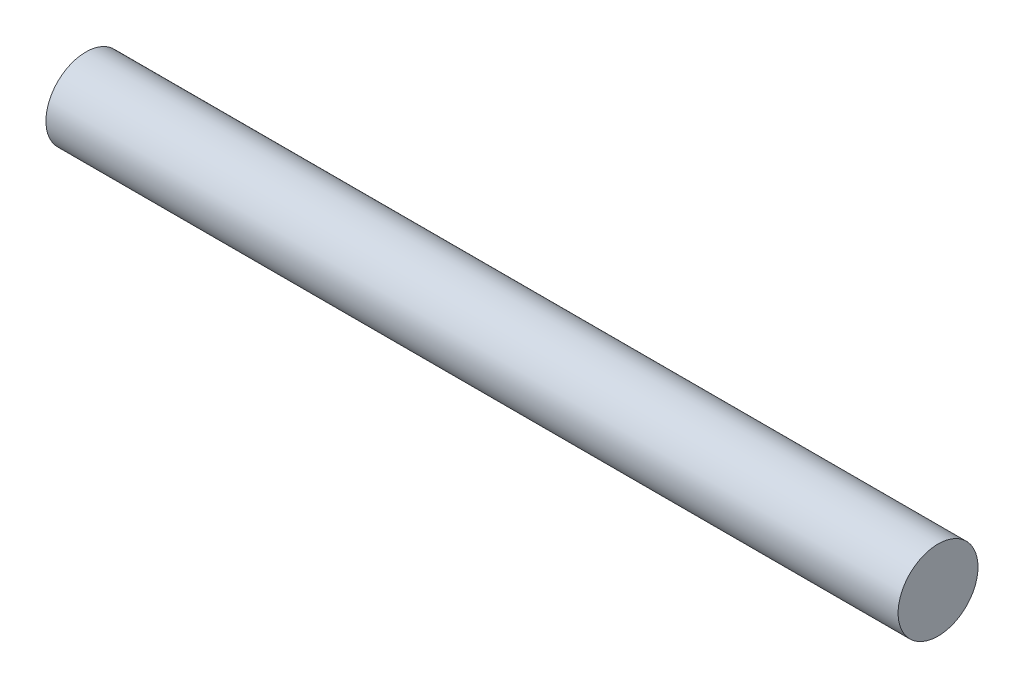
from build123d import *

# Parameters (mm, degrees)
ESBO_O1_R                = 7.5
RESSALTO_EXTRUS_O1_DEPTH = 80


with BuildPart() as part:
    # Esboço1 → Ressalto-extrusão1 (new, symmetric)
    with BuildSketch(Plane(origin=(0, 0, 0), x_dir=(0, 0, -1), z_dir=(1, 0, 0))):
        Circle(ESBO_O1_R)
    extrude(amount=RESSALTO_EXTRUS_O1_DEPTH, both=True)


solid = part.part
